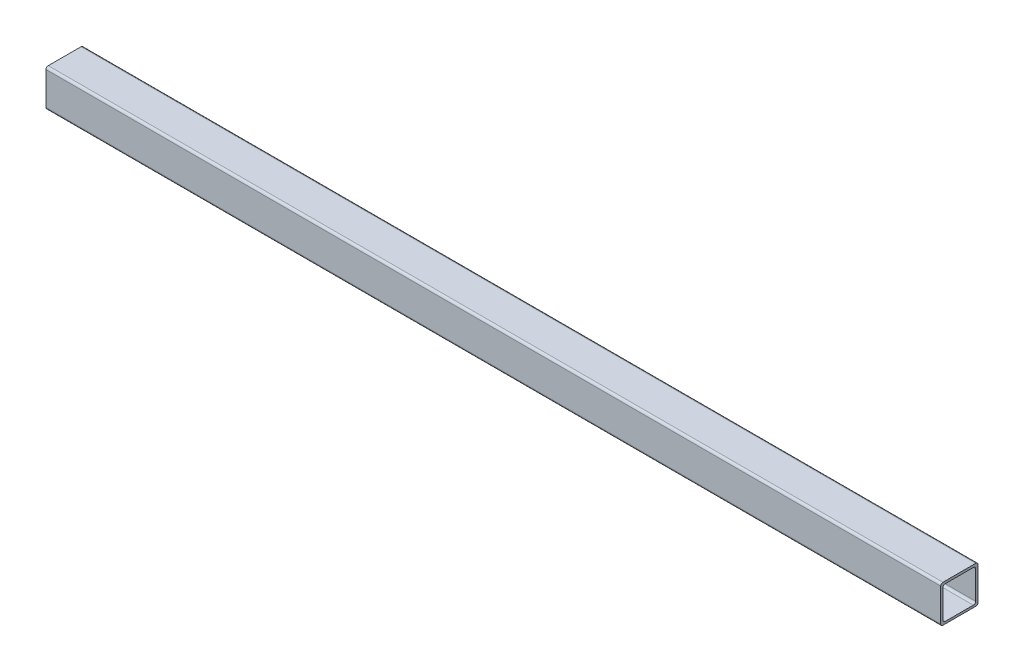
from build123d import *

# Parameters (mm, degrees)
BOSS_EXTRUDE1_DEPTH = 304.8


with BuildPart() as part:
    # Sketch2 → Boss-Extrude1 (new body)
    with BuildSketch(Plane(origin=(0, 0, 0), x_dir=(0, 0, -1), z_dir=(1, 0, 0))):
        with BuildLine():
            Line((0.762, 0), (11.938, 0))
            ThreePointArc((11.938, 0), (12.476815367, 0.223184633), (12.7, 0.762))
            Line((12.7, 0.762), (12.7, 11.938))
            ThreePointArc((12.7, 11.938), (12.476815367, 12.476815367), (11.938, 12.7))
            Line((11.938, 12.7), (0.762, 12.7))
            ThreePointArc((0.762, 12.7), (0.223184633, 12.476815367), (0, 11.938))
            Line((0, 11.938), (0, 0.762))
            ThreePointArc((0, 0.762), (0.223184633, 0.223184633), (0.762, 0))
        make_face()
        with BuildLine():
            Line((1.524, 0.762), (11.1125, 0.762))
            ThreePointArc((11.1125, 0.762), (11.651315367, 0.985184633), (11.8745, 1.524))
            Line((11.8745, 1.524), (11.8745, 11.1125))
            ThreePointArc((11.8745, 11.1125), (11.651315367, 11.651315367), (11.1125, 11.8745))
            Line((11.1125, 11.8745), (1.524, 11.8745))
            ThreePointArc((1.524, 11.8745), (0.985184633, 11.651315367), (0.762, 11.1125))
            Line((0.762, 11.1125), (0.762, 1.524))
            ThreePointArc((0.762, 1.524), (0.985184633, 0.985184633), (1.524, 0.762))
        make_face(mode=Mode.SUBTRACT)
    extrude(amount=BOSS_EXTRUDE1_DEPTH)


solid = part.part
